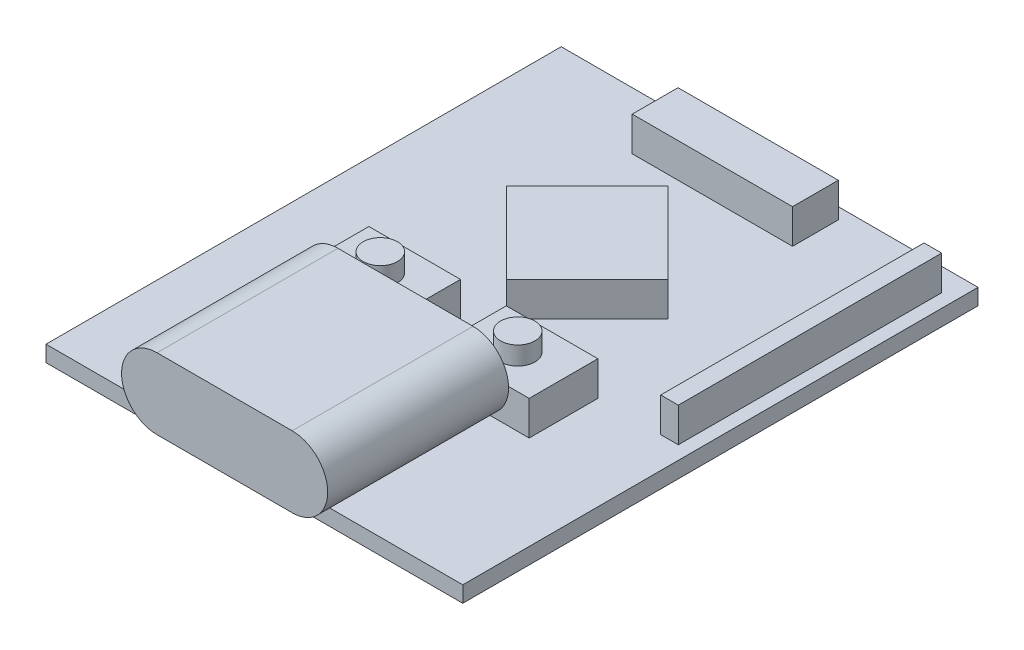
from build123d import *

# Parameters (mm, degrees)
SKETCH_1_W      = 18.2
SKETCH_1_H      = 22.5
EXTRUDE_1_DEPTH = 0.7
EXTRUDE_START   = 1.3
EXTRUDE_2_DEPTH = 7.9
SKETCH_3_W      = 4
SKETCH_3_H      = 3
SKETCH_3_W_2    = 7
SKETCH_3_H_2    = 2
SKETCH_3_W_3    = 0.768063184
SKETCH_3_H_3    = 11.5
EXTRUDE_3_DEPTH = 2.2
SKETCH_4_R      = 0.75
EXTRUDE_4_DEPTH = 3


with BuildPart() as part:
    # Эскиз1 → Бобышка-Вытянуть1 (new body)
    with BuildSketch(Plane(origin=(0, 0, 0), x_dir=(1, 0, 0), z_dir=(0, 1, 0))):
        with Locations((0, 11.25)):
            Rectangle(SKETCH_1_W, SKETCH_1_H)
    extrude(amount=EXTRUDE_1_DEPTH)

    # Эскиз3 → Бобышка-Вытянуть3 (add)
    with BuildSketch(Plane(origin=(0, 0, 0), x_dir=(1, 0, 0), z_dir=(0, 1, 0))):
        Polygon((-3.535533906, 14.535533906), (0, 18.071067812), (3.535533906, 14.535533906), (0, 11), align=None)
        with Locations((-3, 8.5)):
            Rectangle(SKETCH_3_W, SKETCH_3_H)
        with Locations((3, 8.5)):
            Rectangle(SKETCH_3_W, SKETCH_3_H)
        with Locations((0, 21)):
            Rectangle(SKETCH_3_W_2, SKETCH_3_H_2)
        with Locations((8.127829454, 15.75)):
            Rectangle(SKETCH_3_W_3, SKETCH_3_H_3)
    extrude(amount=EXTRUDE_3_DEPTH)

    # Эскиз4 → Бобышка-Вытянуть4 (add)
    with BuildSketch(Plane(origin=(0, 0, 0), x_dir=(1, 0, 0), z_dir=(0, 1, 0))):
        with Locations(Location((3, 8.5, 0), (0, 0, 270))):
            Circle(SKETCH_4_R)
        with Locations(Location((-3, 8.5, 0), (0, 0, 90))):
            Circle(SKETCH_4_R)
    extrude(amount=EXTRUDE_4_DEPTH)


with BuildPart() as body_2:
    # Эскиз2 → Бобышка-Вытянуть2 (new body)
    with BuildSketch(Plane.XY.offset(EXTRUDE_START)):
        with BuildLine():
            Line((-2.95, 4.1), (2.95, 4.1))
            ThreePointArc((2.95, 4.1), (4.5, 2.55), (2.95, 1))
            Line((2.95, 1), (-2.95, 1))
            ThreePointArc((-2.95, 1), (-4.5, 2.55), (-2.95, 4.1))
        make_face()
    extrude(amount=-EXTRUDE_2_DEPTH)


solid = Compound([part.part, body_2.part])
